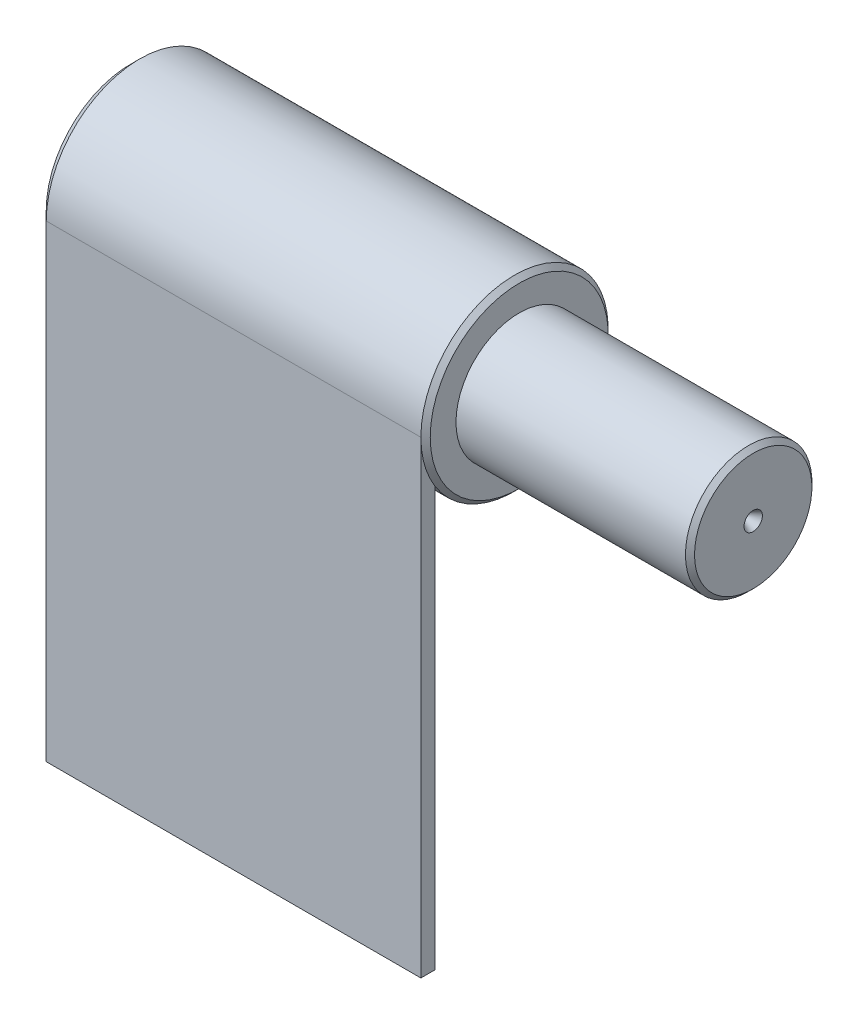
from build123d import *

# Parameters (mm, degrees)
SKETCH_3_W      = 80
SKETCH_3_H      = 3.000052495
EXTRUDE_1_DEPTH = 100


with BuildPart() as part:
    # Эскиз2 → Повернуть1 (revolve)
    with BuildSketch(Plane(origin=(0, 0, 0), x_dir=(1, 0, 0), z_dir=(0, 1, 0)), mode=Mode.PRIVATE) as revolve_1_sk:
        Polygon((-45.527497303, 22.337527379), (34.472502697, 22.337527379), (35.472502697, 21.337527379), (35.472502697, 15.837527379), (84.472502697, 15.837527379), (85.441558376, 14.8684717), (85.441558376, 4.296423316), (82.259183132, 2.337527379), (-47.527497303, 2.337527379), (-47.527497303, 20.337527379), align=None)
    revolve(revolve_1_sk.sketch.rotate(Axis((-58.608041749, 0, -2.337527379), (1, 0, 0)), 180), axis=Axis((-58.608041749, 0, -2.337527379), (1, 0, 0)))

    # Эскиз3 → Бобышка-Вытянуть1 (add)
    with BuildSketch(Plane(origin=(0, 0, 0), x_dir=(1, 0, 0), z_dir=(0, 1, 0))):
        with Locations((-5.527497303, -16.162446374)):
            Rectangle(SKETCH_3_W, SKETCH_3_H)
    extrude(amount=-EXTRUDE_1_DEPTH)


solid = part.part
